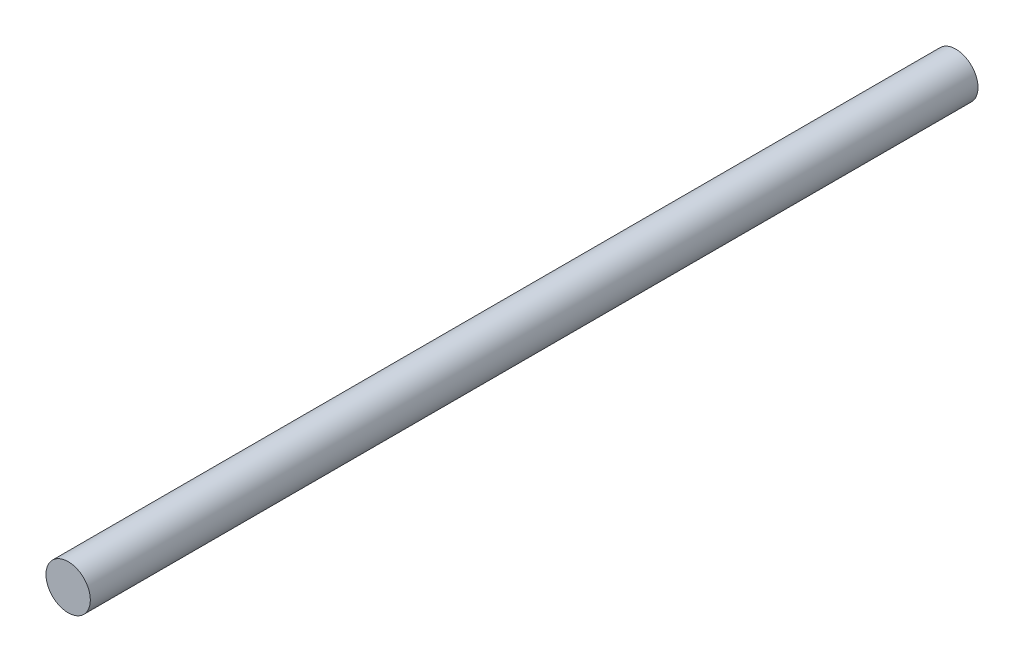
from build123d import *

# Parameters (mm, degrees)
SKETCH1_R           = 4
BOSS_EXTRUDE1_DEPTH = 80


with BuildPart() as part:
    # Sketch1 → Boss-Extrude1 (new, symmetric)
    with BuildSketch(Plane.XY):
        Circle(SKETCH1_R)
    extrude(amount=BOSS_EXTRUDE1_DEPTH, both=True)


solid = part.part
